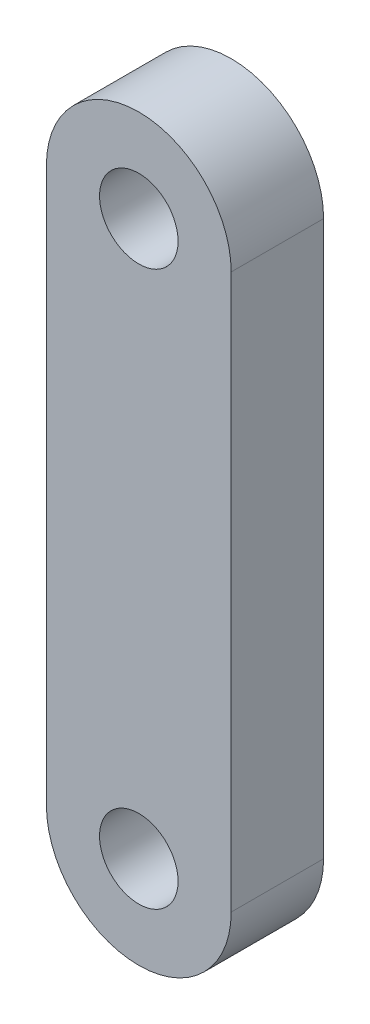
from build123d import *

# Parameters (mm, degrees)
SKETCH_1_R      = 1.7
EXTRUDE_1_DEPTH = 4


with BuildPart() as part:
    # 草图1 → 凸台-拉伸1 (new body)
    with BuildSketch(Plane.XY):
        with BuildLine():
            Line((4, 0), (4, -24))
            ThreePointArc((4, -24), (0, -28), (-4, -24))
            Line((-4, -24), (-4, 0))
            ThreePointArc((-4, 0), (0, 4), (4, 0))
        make_face()
        Circle(SKETCH_1_R, mode=Mode.SUBTRACT)
        with Locations((0, -24)):
            Circle(SKETCH_1_R, mode=Mode.SUBTRACT)
    extrude(amount=EXTRUDE_1_DEPTH)


solid = part.part
